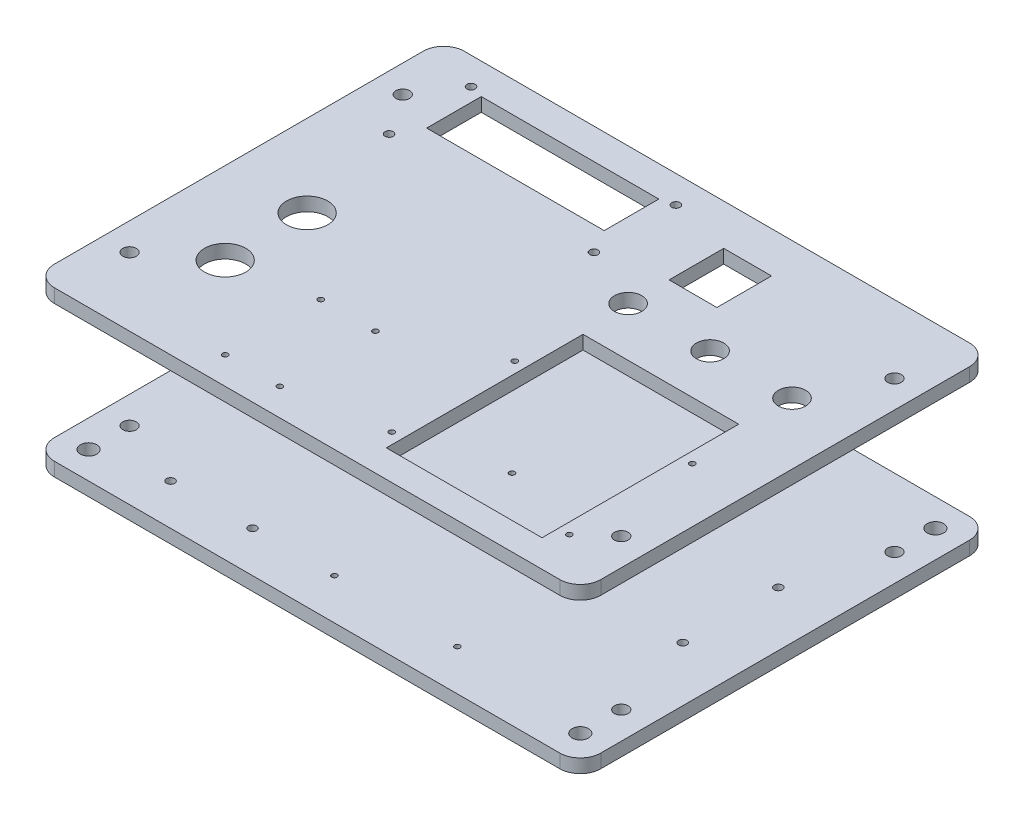
from build123d import *

# Parameters (mm, degrees)
BOSS_EXTRUDE1_START = 10
SKETCH2_W           = 200
SKETCH2_H           = 150
SKETCH2_R           = 1.5
SKETCH2_R_2         = 1
SKETCH2_R_3         = 2.5
SKETCH2_R_4         = 3
BOSS_EXTRUDE1_DEPTH = 5
BOSS_EXTRUDE2_START = 65
SKETCH4_W           = 200
SKETCH4_H           = 150
SKETCH4_R           = 2.5
SKETCH4_R_2         = 1
SKETCH4_R_3         = 7.55
SKETCH4_R_4         = 1.5
SKETCH4_W_2         = 65
SKETCH4_H_2         = 20
SKETCH4_R_5         = 5
SKETCH4_W_3         = 17.5
BOSS_EXTRUDE2_DEPTH = 5
FILLET1_R           = 7.5
FILLET2_R           = 7.5


with BuildPart() as part:
    # Sketch2 → Boss-Extrude1 (new body)
    with BuildSketch(Plane(origin=(0, 0, 0), x_dir=(1, 0, 0), z_dir=(0, 1, 0)).offset(BOSS_EXTRUDE1_START)):
        with Locations((100, -75)):
            Rectangle(SKETCH2_W, SKETCH2_H)
        with Locations(Location((35, -75, 0), (0, 0, 270))):
            Circle(SKETCH2_R, mode=Mode.SUBTRACT)
        with Locations(Location((65, -75, 0), (0, 0, 270))):
            Circle(SKETCH2_R, mode=Mode.SUBTRACT)
        with Locations(Location((65, -135, 0), (0, 0, 270))):
            Circle(SKETCH2_R, mode=Mode.SUBTRACT)
        with Locations(Location((35, -135, 0), (0, 0, 270))):
            Circle(SKETCH2_R, mode=Mode.SUBTRACT)
        with Locations(Location((35, -15, 0), (0, 0, 270))):
            Circle(SKETCH2_R, mode=Mode.SUBTRACT)
        with Locations(Location((125, -15, 0), (0, 0, 270))):
            Circle(SKETCH2_R, mode=Mode.SUBTRACT)
        with Locations(Location((180, -57.5, 0), (0, 0, 270))):
            Circle(SKETCH2_R, mode=Mode.SUBTRACT)
        with Locations(Location((180, -92.5, 0), (0, 0, 270))):
            Circle(SKETCH2_R, mode=Mode.SUBTRACT)
        with Locations(Location((95, -70, 0), (0, 0, 270))):
            Circle(SKETCH2_R_2, mode=Mode.SUBTRACT)
        with Locations(Location((140, -70, 0), (0, 0, 270))):
            Circle(SKETCH2_R_2, mode=Mode.SUBTRACT)
        with Locations(Location((140, -135, 0), (0, 0, 270))):
            Circle(SKETCH2_R_2, mode=Mode.SUBTRACT)
        with Locations(Location((95, -135, 0), (0, 0, 270))):
            Circle(SKETCH2_R_2, mode=Mode.SUBTRACT)
        with Locations(Location((190, -25, 0), (0, 0, 270))):
            Circle(SKETCH2_R_3, mode=Mode.SUBTRACT)
        with Locations(Location((190, -10, 0), (0, 0, 270))):
            Circle(SKETCH2_R_4, mode=Mode.SUBTRACT)
        with Locations(Location((190, -125, 0), (0, 0, 270))):
            Circle(SKETCH2_R_3, mode=Mode.SUBTRACT)
        with Locations(Location((190, -140, 0), (0, 0, 270))):
            Circle(SKETCH2_R_4, mode=Mode.SUBTRACT)
        with Locations(Location((10, -140, 0), (0, 0, 270))):
            Circle(SKETCH2_R_4, mode=Mode.SUBTRACT)
        with Locations(Location((10, -125, 0), (0, 0, 270))):
            Circle(SKETCH2_R_3, mode=Mode.SUBTRACT)
        with Locations(Location((10, -25, 0), (0, 0, 270))):
            Circle(SKETCH2_R_3, mode=Mode.SUBTRACT)
        with Locations(Location((10, -10, 0), (0, 0, 270))):
            Circle(SKETCH2_R_4, mode=Mode.SUBTRACT)
    extrude(amount=BOSS_EXTRUDE1_DEPTH)

    # Fillet1
    fillet1_edges = [part.edges().sort_by_distance(p)[0] for p in [
        (0, 12.5, 0),
        (200, 12.5, 0),
        (200, 12.5, 150),
        (0, 12.5, 150),
    ]]
    fillet(fillet1_edges, radius=FILLET1_R)


with BuildPart() as body_2:
    # Sketch4 → Boss-Extrude2 (new body)
    with BuildSketch(Plane(origin=(0, 0, 0), x_dir=(1, 0, 0), z_dir=(0, 1, 0)).offset(BOSS_EXTRUDE2_START)):
        with Locations((100, -75)):
            Rectangle(SKETCH4_W, SKETCH4_H)
        with Locations(Location((10, -125, 0), (0, 0, 270))):
            Circle(SKETCH4_R, mode=Mode.SUBTRACT)
        with Locations(Location((60, -140, 0), (0, 0, 270))):
            Circle(SKETCH4_R_2, mode=Mode.SUBTRACT)
        with Locations(Location((80, -140, 0), (0, 0, 270))):
            Circle(SKETCH4_R_2, mode=Mode.SUBTRACT)
        with Locations(Location((30, -110, 0), (0, 0, 270))):
            Circle(SKETCH4_R_3, mode=Mode.SUBTRACT)
        with Locations(Location((30, -80, 0), (0, 0, 270))):
            Circle(SKETCH4_R_3, mode=Mode.SUBTRACT)
        with Locations(Location((60, -105, 0), (0, 0, 270))):
            Circle(SKETCH4_R_2, mode=Mode.SUBTRACT)
        with Locations(Location((80, -105, 0), (0, 0, 270))):
            Circle(SKETCH4_R_2, mode=Mode.SUBTRACT)
        with Locations(Location((115, -134, 0), (0, 0, 270))):
            Circle(SKETCH4_R_2, mode=Mode.SUBTRACT)
        with Locations(Location((180, -134, 0), (0, 0, 270))):
            Circle(SKETCH4_R_2, mode=Mode.SUBTRACT)
        with Locations(Location((190, -125, 0), (0, 0, 270))):
            Circle(SKETCH4_R, mode=Mode.SUBTRACT)
        Polygon((119, -130), (119, -93), (119, -68), (176, -68), (176, -93), (176, -130), (176, -140), (119, -140), align=None, mode=Mode.SUBTRACT)
        with Locations(Location((115, -89, 0), (0, 0, 270))):
            Circle(SKETCH4_R_2, mode=Mode.SUBTRACT)
        with Locations(Location((180, -89, 0), (0, 0, 270))):
            Circle(SKETCH4_R_2, mode=Mode.SUBTRACT)
        with Locations(Location((20, -40, 0), (0, 0, 270))):
            Circle(SKETCH4_R_4, mode=Mode.SUBTRACT)
        with Locations(Location((95, -40, 0), (0, 0, 270))):
            Circle(SKETCH4_R_4, mode=Mode.SUBTRACT)
        with Locations(Location((10, -25, 0), (0, 0, 270))):
            Circle(SKETCH4_R, mode=Mode.SUBTRACT)
        with Locations(Location((20, -10, 0), (0, 0, 270))):
            Circle(SKETCH4_R_4, mode=Mode.SUBTRACT)
        with Locations((57.5, -21.25)):
            Rectangle(SKETCH4_W_2, SKETCH4_H_2, mode=Mode.SUBTRACT)
        with Locations(Location((95, -10, 0), (0, 0, 270))):
            Circle(SKETCH4_R_4, mode=Mode.SUBTRACT)
        with Locations(Location((117.5, -50, 0), (0, 0, 270))):
            Circle(SKETCH4_R_5, mode=Mode.SUBTRACT)
        with Locations(Location((147.5, -50, 0), (0, 0, 270))):
            Circle(SKETCH4_R_5, mode=Mode.SUBTRACT)
        with Locations(Location((177.5, -50, 0), (0, 0, 270))):
            Circle(SKETCH4_R_5, mode=Mode.SUBTRACT)
        with Locations((126.25, -25)):
            Rectangle(SKETCH4_W_3, SKETCH4_H_2, mode=Mode.SUBTRACT)
        with Locations(Location((190, -25, 0), (0, 0, 270))):
            Circle(SKETCH4_R, mode=Mode.SUBTRACT)
    extrude(amount=BOSS_EXTRUDE2_DEPTH)

    # Fillet2
    fillet2_edges = [body_2.edges().sort_by_distance(p)[0] for p in [
        (200, 67.5, 0),
        (200, 67.5, 150),
        (0, 67.5, 150),
        (0, 67.5, 0),
    ]]
    fillet(fillet2_edges, radius=FILLET2_R)


solid = Compound([part.part, body_2.part])
